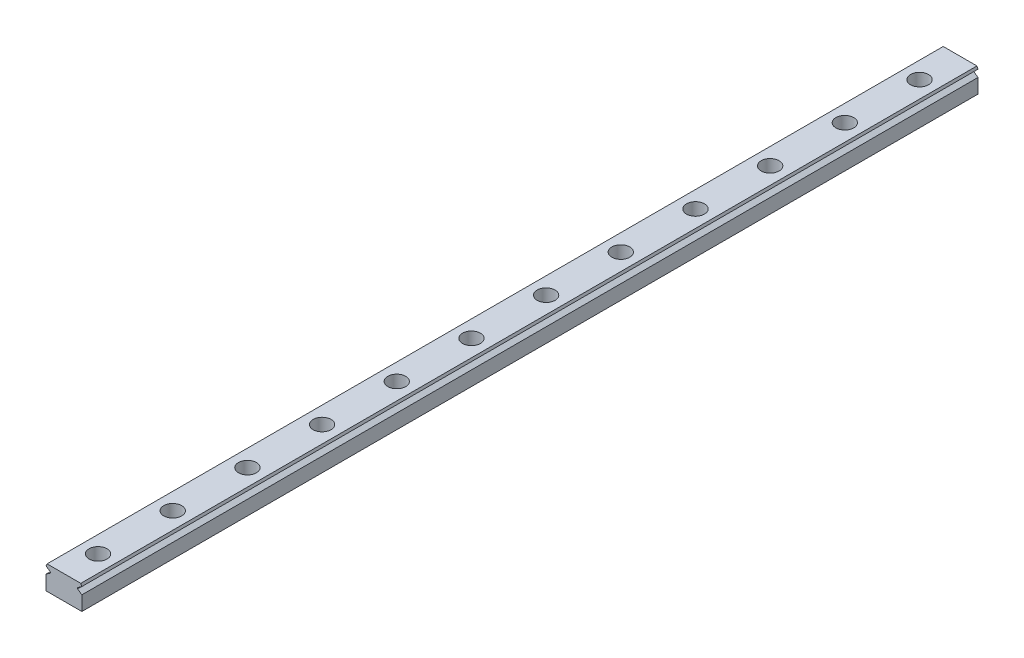
from build123d import *

# Parameters (mm, degrees)
EXTRUDE_1_DEPTH     = 300
SKETCH_2_R          = 3
CUT_EXTRUDE_1_DEPTH = 4.5
SKETCH_5_R          = 1.75
CUT_EXTRUDE_2_DEPTH = 8


with BuildPart() as part:
    # 草图1 → 凸台-拉伸1 (new body)
    with BuildSketch(Plane.XY):
        Polygon((-76.761429644, 75.303838363), (-65.473589828, 75.303838363), (-65.117509736, 74.540222142), (-66.549305548, 73.537667921), (-66.549305548, 73.146885775), (-65.117509736, 72.144331554), (-65.117509736, 67.303838363), (-77.117509736, 67.303838363), (-77.117509736, 72.144331554), (-75.685713923, 73.146885775), (-75.685713923, 73.537667921), (-77.117509736, 74.540222142), align=None)
    extrude(amount=EXTRUDE_1_DEPTH)

    # 草图2 → 切除-拉伸1 (cut)
    with BuildSketch(Plane(origin=(0, 75.303838363, 0), x_dir=(1, 0, 0), z_dir=(0, 1, 0))):
        with Locations(Location((-71.117509736, -13.578086328, 0), (0, 0, 270))):
            Circle(SKETCH_2_R)
        with Locations(Location((-71.117509736, -38.578086328, 0), (0, 0, 270))):
            Circle(SKETCH_2_R)
        with Locations(Location((-71.117509736, -63.578086328, 0), (0, 0, 270))):
            Circle(SKETCH_2_R)
        with Locations(Location((-71.117509736, -88.578086328, 0), (0, 0, 270))):
            Circle(SKETCH_2_R)
        with Locations(Location((-71.117509736, -113.578086328, 0), (0, 0, 270))):
            Circle(SKETCH_2_R)
        with Locations(Location((-71.117509736, -138.578086328, 0), (0, 0, 270))):
            Circle(SKETCH_2_R)
        with Locations(Location((-71.117509736, -163.578086328, 0), (0, 0, 270))):
            Circle(SKETCH_2_R)
        with Locations(Location((-71.117509736, -188.578086328, 0), (0, 0, 270))):
            Circle(SKETCH_2_R)
        with Locations(Location((-71.117509736, -213.578086328, 0), (0, 0, 270))):
            Circle(SKETCH_2_R)
        with Locations(Location((-71.117509736, -238.578086328, 0), (0, 0, 270))):
            Circle(SKETCH_2_R)
        with Locations(Location((-71.117509736, -263.578086328, 0), (0, 0, 270))):
            Circle(SKETCH_2_R)
        with Locations(Location((-71.117509736, -288.578086328, 0), (0, 0, 270))):
            Circle(SKETCH_2_R)
    extrude(amount=-CUT_EXTRUDE_1_DEPTH, mode=Mode.SUBTRACT)

    # 草图5 → 切除-拉伸2 (cut)
    with BuildSketch(Plane(origin=(0, 75.303838363, 0), x_dir=(1, 0, 0), z_dir=(0, 1, 0))):
        with Locations(Location((-71.117509736, -13.578086328, 0), (0, 0, 270))):
            Circle(SKETCH_5_R)
        with Locations(Location((-71.117509736, -38.578086328, 0), (0, 0, 270))):
            Circle(SKETCH_5_R)
        with Locations(Location((-71.117509736, -63.578086328, 0), (0, 0, 270))):
            Circle(SKETCH_5_R)
        with Locations(Location((-71.117509736, -88.578086328, 0), (0, 0, 270))):
            Circle(SKETCH_5_R)
        with Locations(Location((-71.117509736, -113.578086328, 0), (0, 0, 270))):
            Circle(SKETCH_5_R)
        with Locations(Location((-71.117509736, -138.578086328, 0), (0, 0, 270))):
            Circle(SKETCH_5_R)
        with Locations(Location((-71.117509736, -163.578086328, 0), (0, 0, 270))):
            Circle(SKETCH_5_R)
        with Locations(Location((-71.117509736, -188.578086328, 0), (0, 0, 270))):
            Circle(SKETCH_5_R)
        with Locations(Location((-71.117509736, -213.578086328, 0), (0, 0, 270))):
            Circle(SKETCH_5_R)
        with Locations(Location((-71.117509736, -238.578086328, 0), (0, 0, 270))):
            Circle(SKETCH_5_R)
        with Locations(Location((-71.117509736, -263.578086328, 0), (0, 0, 270))):
            Circle(SKETCH_5_R)
        with Locations(Location((-71.117509736, -288.578086328, 0), (0, 0, 270))):
            Circle(SKETCH_5_R)
    extrude(amount=-CUT_EXTRUDE_2_DEPTH, mode=Mode.SUBTRACT)


solid = part.part
